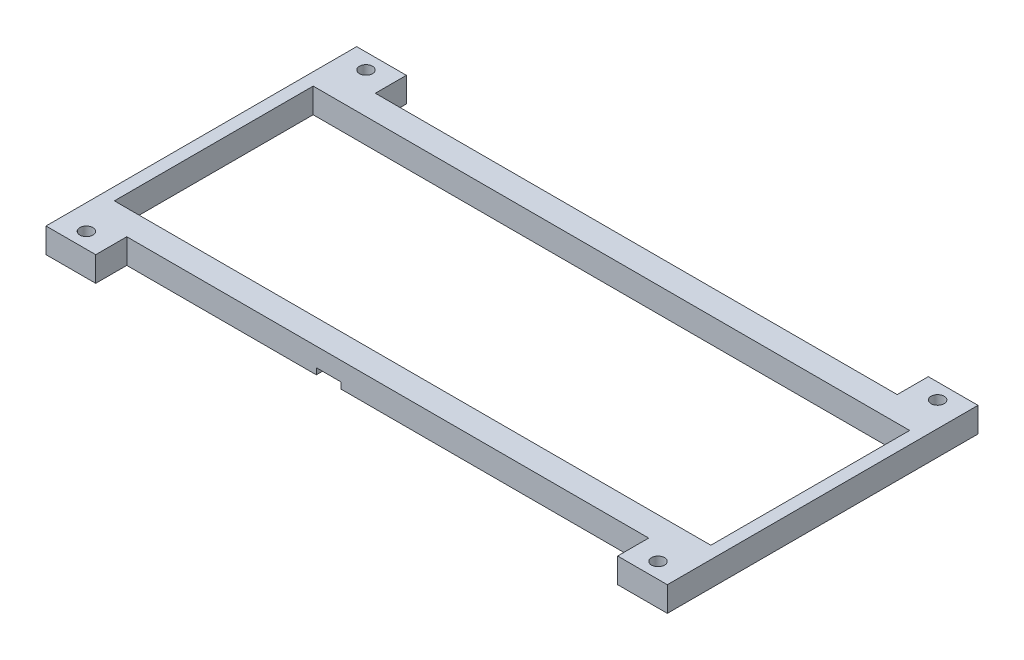
from build123d import *

# Parameters (mm, degrees)
SKETCH_1_R          = 2.1
SKETCH_1_W          = 192
SKETCH_1_H          = 64
EXTRUDE_1_DEPTH     = 8
SKETCH_3_W          = 8
SKETCH_3_H          = 8
CUT_EXTRUDE_1_DEPTH = 2


with BuildPart() as part:
    # Эскиз1 → Бобышка-Вытянуть1 (new body)
    with BuildSketch(Plane(origin=(0, 8, 0), x_dir=(1, 0, 0), z_dir=(0, 1, 0))):
        Polygon((109.289774647, 94.419345598), (109.289774647, -5.580654402), (93.289774647, -5.580654402), (93.289774647, 4.419345598), (-74.710225353, 4.419345598), (-74.710225353, -5.580654402), (-90.710225353, -5.580654402), (-90.710225353, 94.419345598), (-74.710225353, 94.419345598), (-74.710225353, 84.419345598), (93.289774647, 84.419345598), (93.289774647, 94.419345598), align=None)
        with Locations(Location((-82.710225353, 89.419345598, 0), (0, 0, 180))):
            Circle(SKETCH_1_R, mode=Mode.SUBTRACT)
        with Locations(Location((-82.710225353, -0.580654402, 0), (0, 0, 180))):
            Circle(SKETCH_1_R, mode=Mode.SUBTRACT)
        with Locations(Location((101.289774647, -0.580654402, 0), (0, 0, 180))):
            Circle(SKETCH_1_R, mode=Mode.SUBTRACT)
        with Locations(Location((101.289774647, 89.419345598, 0), (0, 0, 180))):
            Circle(SKETCH_1_R, mode=Mode.SUBTRACT)
        with Locations((9.289774647, 44.419345598)):
            Rectangle(SKETCH_1_W, SKETCH_1_H, mode=Mode.SUBTRACT)
    extrude(amount=EXTRUDE_1_DEPTH)

    # Эскиз3 → Вырез-Вытянуть1 (cut)
    with BuildSketch(Plane(origin=(0, 8, 0), x_dir=(1, 0, 0), z_dir=(0, 1, 0))):
        with Locations((-9.710225353, 8.419345598)):
            Rectangle(SKETCH_3_W, SKETCH_3_H)
    extrude(amount=CUT_EXTRUDE_1_DEPTH, mode=Mode.SUBTRACT)


solid = part.part
